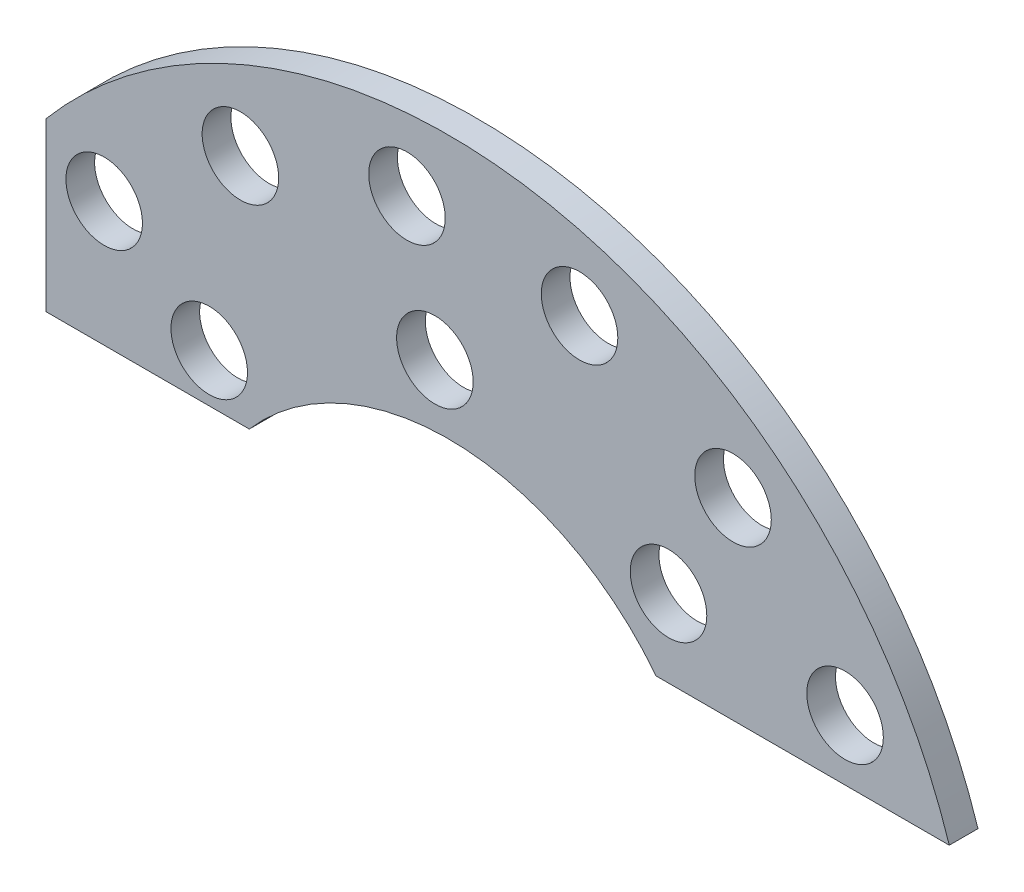
from build123d import *

# Parameters (mm, degrees)
SKETCH2_R           = 4
BOSS_EXTRUDE1_DEPTH = 3


with BuildPart() as part:
    # Sketch2 → Boss-Extrude1 (new body)
    # profile 1 of 3: a face of its own
    with BuildSketch(Plane.XY.offset(29.670544835)):
        with BuildLine():
            ThreePointArc((6.802372388, 14.495325214), (-28.853343247, 37.601496731), (-65.190306526, 15.582179772))
            Line((-65.190306526, 15.582179772), (-50.268412727, 15.582179772))
            ThreePointArc((-50.268412727, 15.582179772), (-28.754344017, 25.097072211), (-7.754551371, 14.495325214))
            Line((-7.754551371, 14.495325214), (6.802372388, 14.495325214))
        make_face()
        with Locations((-54.457143935, 20.606054181)):
            Circle(SKETCH2_R, mode=Mode.SUBTRACT)
        with Locations((-30.871357497, 31.547179678)):
            Circle(SKETCH2_R, mode=Mode.SUBTRACT)
        with Locations((-6.457143935, 22.606054181)):
            Circle(SKETCH2_R, mode=Mode.SUBTRACT)
    # profile 2 of 3: a face of its own
    with BuildSketch(Plane.XY.offset(29.670544835)):
        with BuildLine():
            ThreePointArc((-67.915477314, 25.484479418), (-69.818945991, 22.649515101), (-71.513826382, 19.685127113))
            Line((-71.513826382, 19.685127113), (-71.513826382, 15.582179772))
            Line((-71.513826382, 15.582179772), (-65.190306526, 15.582179772))
            ThreePointArc((-65.190306526, 15.582179772), (-28.853343247, 37.601496731), (6.802372388, 14.495325214))
            Line((6.802372388, 14.495325214), (14.938830252, 14.495325214))
            ThreePointArc((14.938830252, 14.495325214), (14.389447504, 15.874234692), (13.797248858, 17.235305417))
            ThreePointArc((13.797248858, 17.235305417), (8.501873451, 18.851359524), (9.893531234, 24.21008327))
            ThreePointArc((9.893531234, 24.21008327), (6.804255556, 28.287659534), (3.294383766, 32.009359739))
            ThreePointArc((3.294383766, 32.009359739), (-2.22078734, 31.524056472), (-2.93787796, 37.013902793))
            ThreePointArc((-2.93787796, 37.013902793), (-7.329691445, 39.637302632), (-11.978161336, 41.773181859))
            ThreePointArc((-11.978161336, 41.773181859), (-16.909941136, 39.257197046), (-19.63134861, 44.078667044))
            ThreePointArc((-19.63134861, 44.078667044), (-24.686110043, 44.86583873), (-29.796210715, 45.104843995))
            ThreePointArc((-29.796210715, 45.104843995), (-29.792572401, 45.00640165), (-29.791359384, 44.907899562))
            ThreePointArc((-29.791359384, 44.907899562), (-33.524574673, 40.916806239), (-37.755772343, 44.375518221))
            ThreePointArc((-37.755772343, 44.375518221), (-42.737345236, 43.211824139), (-47.564881022, 41.519148556))
            ThreePointArc((-47.564881022, 41.519148556), (-47.288818763, 40.699632679), (-47.195341682, 39.839935825))
            ThreePointArc((-47.195341682, 39.839935825), (-50.171922049, 35.97307505), (-54.67164781, 37.861225208))
            ThreePointArc((-54.67164781, 37.861225208), (-58.85455429, 34.916136792), (-62.696480095, 31.538288585))
            ThreePointArc((-62.696480095, 31.538288585), (-61.762829246, 30.210656667), (-61.433540443, 28.621355152))
            ThreePointArc((-61.433540443, 28.621355152), (-63.691092092, 25.020817172), (-67.915477314, 25.484479418))
        make_face()
    # profile 3 of 3: a face of its own
    with BuildSketch(Plane.XY.offset(29.670544835)):
        with BuildLine():
            ThreePointArc((22.885501432, 14.495325214), (-18.849868318, 51.573504594), (-71.513826382, 33.049466285))
            Line((-71.513826382, 33.049466285), (-71.513826382, 19.685127113))
            ThreePointArc((-71.513826382, 19.685127113), (-69.818945991, 22.649515101), (-67.915477314, 25.484479418))
            ThreePointArc((-67.915477314, 25.484479418), (-68.463131728, 31.233169971), (-62.696480095, 31.538288585))
            ThreePointArc((-62.696480095, 31.538288585), (-58.85455429, 34.916136792), (-54.67164781, 37.861225208))
            ThreePointArc((-54.67164781, 37.861225208), (-53.025926756, 43.396473227), (-47.564881022, 41.519148556))
            ThreePointArc((-47.564881022, 41.519148556), (-42.737345236, 43.211824139), (-37.755772343, 44.375518221))
            ThreePointArc((-37.755772343, 44.375518221), (-34.156345949, 48.891212858), (-29.796210715, 45.104843995))
            ThreePointArc((-29.796210715, 45.104843995), (-24.686110043, 44.86583873), (-19.63134861, 44.078667044))
            ThreePointArc((-19.63134861, 44.078667044), (-15.256521979, 47.055857815), (-11.756175362, 43.087187195))
            ThreePointArc((-11.756175362, 43.087187195), (-11.812062273, 42.420874994), (-11.978161336, 41.773181859))
            ThreePointArc((-11.978161336, 41.773181859), (-7.329691445, 39.637302632), (-2.93787796, 37.013902793))
            ThreePointArc((-2.93787796, 37.013902793), (1.531436617, 38.443369839), (4.283705221, 34.642953235))
            ThreePointArc((4.283705221, 34.642953235), (4.028215481, 33.23631081), (3.294383766, 32.009359739))
            ThreePointArc((3.294383766, 32.009359739), (6.804255556, 28.287659534), (9.893531234, 24.21008327))
            ThreePointArc((9.893531234, 24.21008327), (13.942318539, 24.297464692), (15.992357809, 20.804950819))
            ThreePointArc((15.992357809, 20.804950819), (15.399670841, 18.709666137), (13.797248858, 17.235305417))
            ThreePointArc((13.797248858, 17.235305417), (14.389447504, 15.874234692), (14.938830252, 14.495325214))
            Line((14.938830252, 14.495325214), (22.885501432, 14.495325214))
        make_face()
    extrude(amount=BOSS_EXTRUDE1_DEPTH)


solid = part.part
